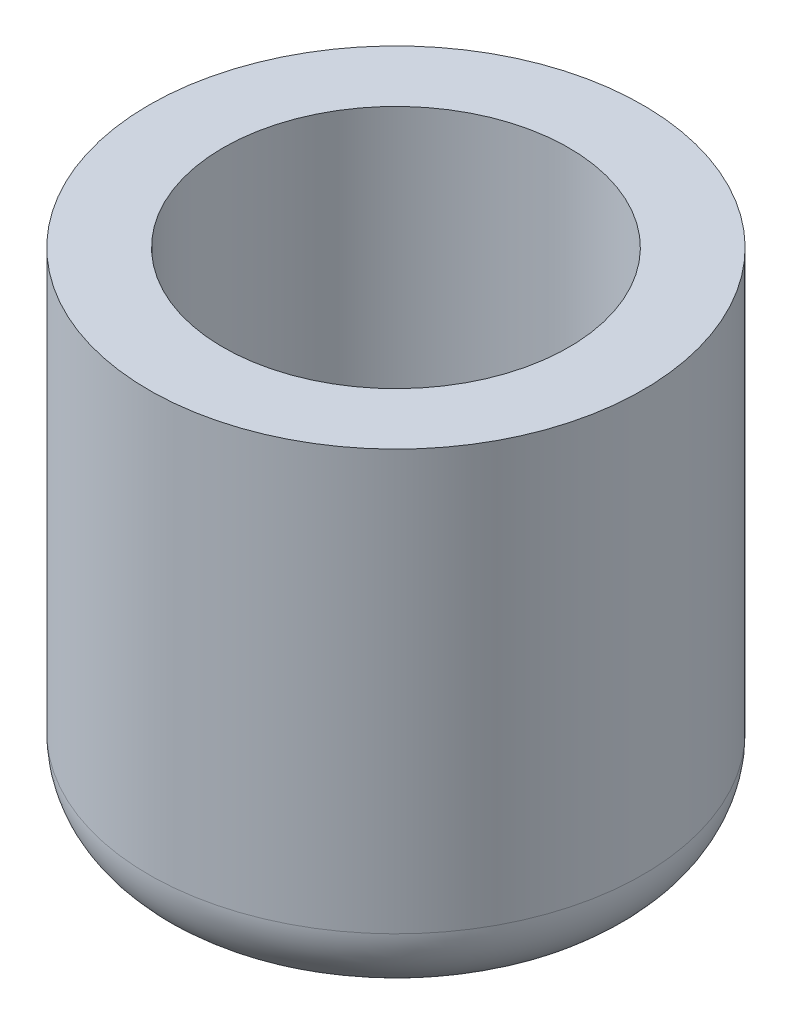
from build123d import *

# Parameters (mm, degrees)
FILLET_1_R = 1.5


with BuildPart() as part:
    # Эскиз1 → Повернуть-Тонкостенный1 (revolve)
    with BuildSketch(Plane.XY):
        Polygon((0, -10), (-5, -10), (-5, 0), (-3.5, 0), (-3.5, -8.5), (0, -8.5), align=None)
    revolve(axis=Axis((0, 0, 0), (0, -1, 0)))

    # Скругление1
    fillet_1_edges = [part.edges().sort_by_distance(p)[0] for p in [
        (5, -10, 0),
    ]]
    fillet(fillet_1_edges, radius=FILLET_1_R)


solid = part.part
